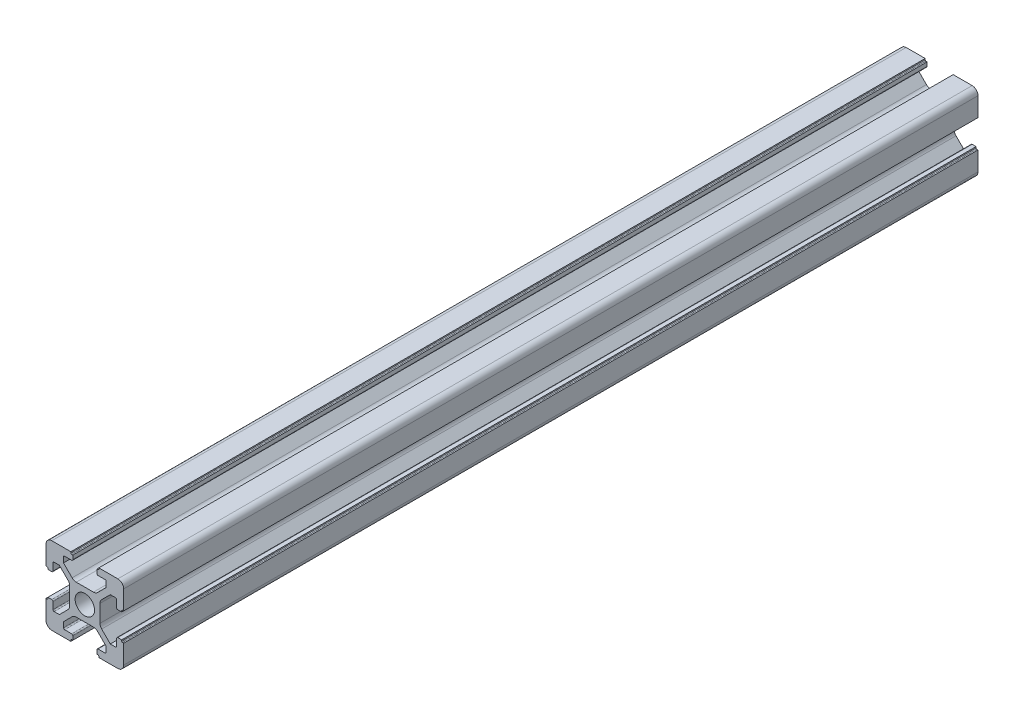
from build123d import *

# Parameters (mm, degrees)
SKETCH_1_R      = 2.5
EXTRUDE_1_DEPTH = 220


with BuildPart() as part:
    # 草图1 → 凸台-拉伸1 (new body)
    with BuildSketch(Plane.XY):
        with BuildLine():
            Line((4.215995631, 3.244230202), (6.436655803, 5.464890373))
            Line((6.436655803, 5.464890373), (7.776655803, 5.464890373))
            ThreePointArc((7.776655803, 5.464890373), (7.988787838, 5.377022408), (8.076655803, 5.164890373))
            Line((8.076655803, 5.164890373), (8.076655803, 3.364890373))
            ThreePointArc((8.076655803, 3.364890373), (8.164523769, 3.152758339), (8.376655803, 3.064890373))
            Line((8.376655803, 3.064890373), (9.376655803, 3.064890373))
            Line((9.376655803, 3.064890373), (9.376655803, 3.364890373))
            ThreePointArc((9.376655803, 3.364890373), (9.435234447, 3.50631173), (9.576655803, 3.564890373))
            Line((9.576655803, 3.564890373), (9.876655803, 3.564890373))
            Line((9.876655803, 3.564890373), (9.876655803, 8.464890373))
            ThreePointArc((9.876655803, 8.464890373), (9.437315975, 9.525550545), (8.376655803, 9.964890373))
            Line((8.376655803, 9.964890373), (3.476655803, 9.964890373))
            Line((3.476655803, 9.964890373), (3.476655803, 9.664890373))
            ThreePointArc((3.476655803, 9.664890373), (3.418077159, 9.523469017), (3.276655803, 9.464890373))
            Line((3.276655803, 9.464890373), (2.976655803, 9.464890373))
            Line((2.976655803, 9.464890373), (2.976655803, 8.464890373))
            ThreePointArc((2.976655803, 8.464890373), (3.064523769, 8.252758339), (3.276655803, 8.164890373))
            Line((3.276655803, 8.164890373), (5.076655803, 8.164890373))
            ThreePointArc((5.076655803, 8.164890373), (5.288787838, 8.077022408), (5.376655803, 7.864890373))
            Line((5.376655803, 7.864890373), (5.376655803, 6.524890373))
            Line((5.376655803, 6.524890373), (3.155995631, 4.304230202))
            ThreePointArc((3.155995631, 4.304230202), (2.669360608, 3.979071075), (2.09533546, 3.864890373))
            Line((2.09533546, 3.864890373), (-2.342023853, 3.864890373))
            ThreePointArc((-2.342023853, 3.864890373), (-2.916049002, 3.979071075), (-3.402684025, 4.304230202))
            Line((-3.402684025, 4.304230202), (-5.623344197, 6.524890373))
            Line((-5.623344197, 6.524890373), (-5.623344197, 7.864890373))
            ThreePointArc((-5.623344197, 7.864890373), (-5.535476231, 8.077022408), (-5.323344197, 8.164890373))
            Line((-5.323344197, 8.164890373), (-3.523344197, 8.164890373))
            ThreePointArc((-3.523344197, 8.164890373), (-3.311212162, 8.252758339), (-3.223344197, 8.464890373))
            Line((-3.223344197, 8.464890373), (-3.223344197, 9.464890373))
            Line((-3.223344197, 9.464890373), (-3.523344197, 9.464890373))
            ThreePointArc((-3.523344197, 9.464890373), (-3.664765553, 9.523469017), (-3.723344197, 9.664890373))
            Line((-3.723344197, 9.664890373), (-3.723344197, 9.964890373))
            Line((-3.723344197, 9.964890373), (-8.623344197, 9.964890373))
            ThreePointArc((-8.623344197, 9.964890373), (-9.684004369, 9.525550545), (-10.123344197, 8.464890373))
            Line((-10.123344197, 8.464890373), (-10.123344197, 3.564890373))
            Line((-10.123344197, 3.564890373), (-9.823344197, 3.564890373))
            ThreePointArc((-9.823344197, 3.564890373), (-9.681922841, 3.50631173), (-9.623344197, 3.364890373))
            Line((-9.623344197, 3.364890373), (-9.623344197, 3.064890373))
            Line((-9.623344197, 3.064890373), (-8.623344197, 3.064890373))
            ThreePointArc((-8.623344197, 3.064890373), (-8.411212162, 3.152758339), (-8.323344197, 3.364890373))
            Line((-8.323344197, 3.364890373), (-8.323344197, 5.164890373))
            ThreePointArc((-8.323344197, 5.164890373), (-8.235476231, 5.377022408), (-8.023344197, 5.464890373))
            Line((-8.023344197, 5.464890373), (-6.683344197, 5.464890373))
            Line((-6.683344197, 5.464890373), (-4.462684025, 3.244230202))
            ThreePointArc((-4.462684025, 3.244230202), (-4.137524898, 2.757595178), (-4.023344197, 2.18357003))
            Line((-4.023344197, 2.18357003), (-4.023344197, -2.253789283))
            ThreePointArc((-4.023344197, -2.253789283), (-4.137524898, -2.827814432), (-4.462684025, -3.314449455))
            Line((-4.462684025, -3.314449455), (-6.683344197, -5.535109627))
            Line((-6.683344197, -5.535109627), (-8.023344197, -5.535109627))
            ThreePointArc((-8.023344197, -5.535109627), (-8.235476231, -5.447241661), (-8.323344197, -5.235109627))
            Line((-8.323344197, -5.235109627), (-8.323344197, -3.435109627))
            ThreePointArc((-8.323344197, -3.435109627), (-8.411212162, -3.222977592), (-8.623344197, -3.135109627))
            Line((-8.623344197, -3.135109627), (-9.623344197, -3.135109627))
            Line((-9.623344197, -3.135109627), (-9.623344197, -3.435109627))
            ThreePointArc((-9.623344197, -3.435109627), (-9.681922841, -3.576530983), (-9.823344197, -3.635109627))
            Line((-9.823344197, -3.635109627), (-10.123344197, -3.635109627))
            Line((-10.123344197, -3.635109627), (-10.123344197, -8.535109627))
            ThreePointArc((-10.123344197, -8.535109627), (-9.684004369, -9.595769798), (-8.623344197, -10.035109627))
            Line((-8.623344197, -10.035109627), (-3.723344197, -10.035109627))
            Line((-3.723344197, -10.035109627), (-3.723344197, -9.735109627))
            ThreePointArc((-3.723344197, -9.735109627), (-3.664765553, -9.59368827), (-3.523344197, -9.535109627))
            Line((-3.523344197, -9.535109627), (-3.223344197, -9.535109627))
            Line((-3.223344197, -9.535109627), (-3.223344197, -8.535109627))
            ThreePointArc((-3.223344197, -8.535109627), (-3.311212162, -8.322977592), (-3.523344197, -8.235109627))
            Line((-3.523344197, -8.235109627), (-5.323344197, -8.235109627))
            ThreePointArc((-5.323344197, -8.235109627), (-5.535476231, -8.147241661), (-5.623344197, -7.935109627))
            Line((-5.623344197, -7.935109627), (-5.623344197, -6.595109627))
            Line((-5.623344197, -6.595109627), (-3.402684025, -4.374449455))
            ThreePointArc((-3.402684025, -4.374449455), (-2.916049002, -4.049290328), (-2.342023853, -3.935109627))
            Line((-2.342023853, -3.935109627), (2.09533546, -3.935109627))
            ThreePointArc((2.09533546, -3.935109627), (2.669360608, -4.049290328), (3.155995631, -4.374449455))
            Line((3.155995631, -4.374449455), (5.376655803, -6.595109627))
            Line((5.376655803, -6.595109627), (5.376655803, -7.935109627))
            ThreePointArc((5.376655803, -7.935109627), (5.288787838, -8.147241661), (5.076655803, -8.235109627))
            Line((5.076655803, -8.235109627), (3.276655803, -8.235109627))
            ThreePointArc((3.276655803, -8.235109627), (3.064523769, -8.322977592), (2.976655803, -8.535109627))
            Line((2.976655803, -8.535109627), (2.976655803, -9.535109627))
            Line((2.976655803, -9.535109627), (3.276655803, -9.535109627))
            ThreePointArc((3.276655803, -9.535109627), (3.418077159, -9.59368827), (3.476655803, -9.735109627))
            Line((3.476655803, -9.735109627), (3.476655803, -10.035109627))
            Line((3.476655803, -10.035109627), (8.376655803, -10.035109627))
            ThreePointArc((8.376655803, -10.035109627), (9.437315975, -9.595769798), (9.876655803, -8.535109627))
            Line((9.876655803, -8.535109627), (9.876655803, -3.635109627))
            Line((9.876655803, -3.635109627), (9.576655803, -3.635109627))
            ThreePointArc((9.576655803, -3.635109627), (9.435234447, -3.576530983), (9.376655803, -3.435109627))
            Line((9.376655803, -3.435109627), (9.376655803, -3.135109627))
            Line((9.376655803, -3.135109627), (8.376655803, -3.135109627))
            ThreePointArc((8.376655803, -3.135109627), (8.164523769, -3.222977592), (8.076655803, -3.435109627))
            Line((8.076655803, -3.435109627), (8.076655803, -5.235109627))
            ThreePointArc((8.076655803, -5.235109627), (7.988787838, -5.447241661), (7.776655803, -5.535109627))
            Line((7.776655803, -5.535109627), (6.436655803, -5.535109627))
            Line((6.436655803, -5.535109627), (4.215995631, -3.314449455))
            ThreePointArc((4.215995631, -3.314449455), (3.890836504, -2.827814432), (3.776655803, -2.253789283))
            Line((3.776655803, -2.253789283), (3.776655803, 2.18357003))
            ThreePointArc((3.776655803, 2.18357003), (3.890836504, 2.757595178), (4.215995631, 3.244230202))
        make_face()
        with Locations((-0.123344197, -0.035109627)):
            Circle(SKETCH_1_R, mode=Mode.SUBTRACT)
    extrude(amount=EXTRUDE_1_DEPTH)


solid = part.part
